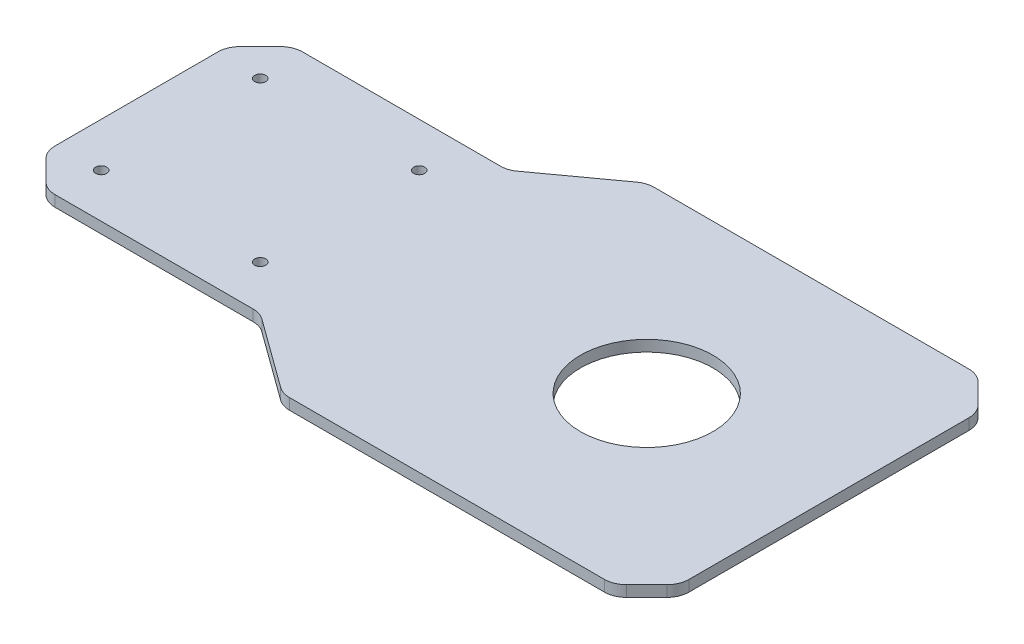
from build123d import *

# Parameters (mm, degrees)
BOSS_EXTRUDE1_DEPTH = 5
CHAMFER1_SIZE       = 15
FILLET1_R           = 10
SKETCH3_R           = 2.5
SKETCH3_R_2         = 30
CUT_EXTRUDE1_DEPTH  = 271.43945718


with BuildPart() as part:
    # Sketch2 → Boss-Extrude1 (new body)
    with BuildSketch(Plane(origin=(0, 0, 0), x_dir=(1, 0, 0), z_dir=(0, 1, 0))):
        Polygon((56, 56), (92.5, 82.5), (257.5, 82.5), (257.5, -82.5), (92.5, -82.5), (56, -56), (-56, -56), (-56, 56), align=None)
    extrude(amount=BOSS_EXTRUDE1_DEPTH)

    # Chamfer1
    chamfer1_edges = [part.edges().sort_by_distance(p)[0] for p in [
        (257.5, 2.5, 82.5),
        (-56, 2.5, 56),
        (-56, 2.5, -56),
        (257.5, 2.5, -82.5),
    ]]
    chamfer(chamfer1_edges, length=CHAMFER1_SIZE)

    # Fillet1
    fillet1_edges = [part.edges().sort_by_distance(p)[0] for p in [
        (92.5, 2.5, 82.5),
        (56, 2.5, 56),
        (56, 2.5, -56),
        (92.5, 2.5, -82.5),
        (-56, 2.5, 41),
        (-56, 2.5, -41),
        (-41, 2.5, -56),
        (-41, 2.5, 56),
        (242.5, 2.5, -82.5),
        (257.5, 2.5, 67.5),
        (257.5, 2.5, -67.5),
        (242.5, 2.5, 82.5),
    ]]
    fillet(fillet1_edges, radius=FILLET1_R)

    # Sketch3 → Cut-Extrude1 (cut, through all)
    with BuildSketch(Plane(origin=(0, 5, 0), x_dir=(1, 0, 0), z_dir=(0, 1, 0))):
        with Locations(Location((36, 36, 0), (0, 0, 270))):
            Circle(SKETCH3_R)
        with Locations(Location((-36, 36, 0), (0, 0, 270))):
            Circle(SKETCH3_R)
        with Locations(Location((-36, -36, 0), (0, 0, 270))):
            Circle(SKETCH3_R)
        with Locations(Location((36, -36, 0), (0, 0, 270))):
            Circle(SKETCH3_R)
        with Locations(Location((175, 0, 0), (0, 0, 270))):
            Circle(SKETCH3_R_2)
    extrude(amount=-CUT_EXTRUDE1_DEPTH, mode=Mode.SUBTRACT)


solid = part.part
